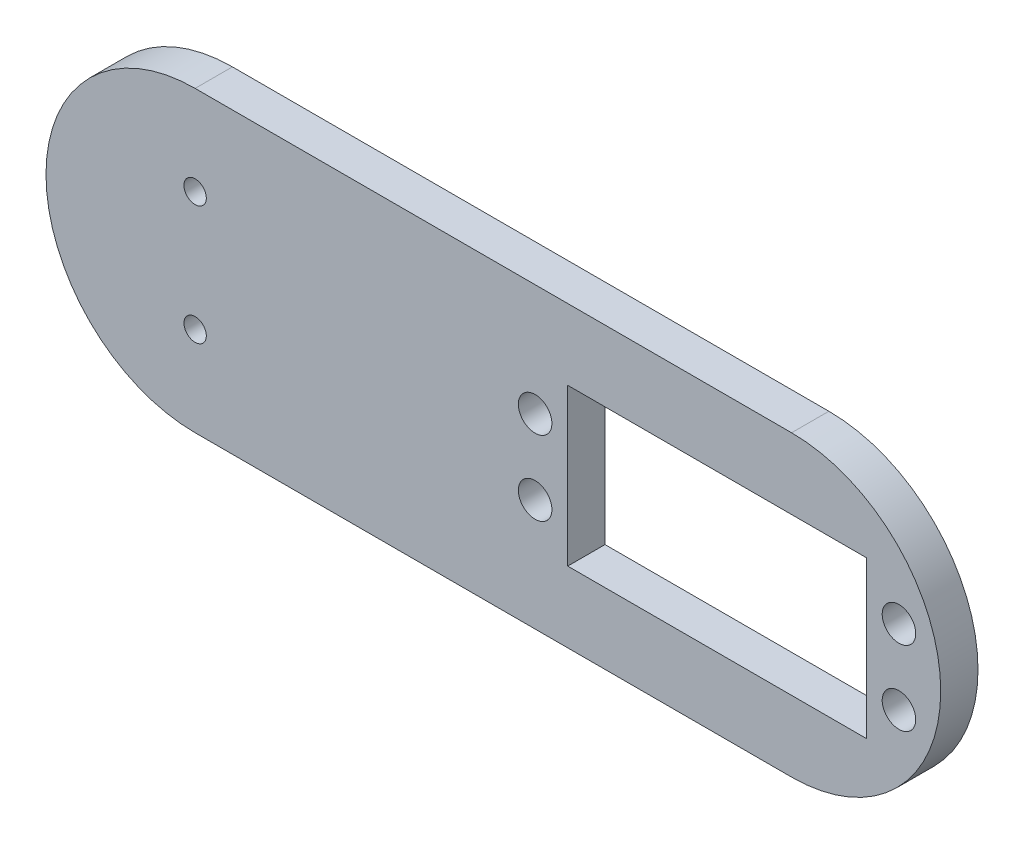
from build123d import *

# Parameters (mm, degrees)
BOSS_EXTRUDE1_DEPTH   = 5
CUT_EXTRUDE1_REACH    = 104.103
SKETCH2_R             = 1.5
BODY_MOVE_COPY1_ANGLE = 90
SKETCH19_R            = 2.25
SKETCH19_W            = 40.05
SKETCH19_H            = 21
CUT_EXTRUDE9_DEPTH    = 103.102889283


with BuildPart() as part:
    # Sketch1 → Boss-Extrude1 (new body)
    with BuildSketch(Plane(origin=(0, 0, 0), x_dir=(1, 0, 0), z_dir=(0, 1, 0))):
        with BuildLine():
            Line((80, -20), (0, -20))
            ThreePointArc((0, -20), (-20, 0), (0, 20))
            Line((0, 20), (80, 20))
            ThreePointArc((80, 20), (100, 0), (80, -20))
        make_face()
    extrude(amount=BOSS_EXTRUDE1_DEPTH)

    # Sketch2 → Cut-Extrude1 (cut, up to next)
    with BuildSketch(Plane(origin=(0, 5, 0), x_dir=(1, 0, 0), z_dir=(0, 1, 0)), mode=Mode.PRIVATE) as cut_extrude1_sk1:
        with Locations(Location((0.002, 7.999999875, 0), (0, 0, 270))):
            Circle(SKETCH2_R)
    cut_extrude1_tool1 = extrude(cut_extrude1_sk1.sketch, amount=-CUT_EXTRUDE1_REACH, mode=Mode.PRIVATE) & part.part
    # Sketch2 → Cut-Extrude1 (cut, up to next)
    with BuildSketch(Plane(origin=(0, 5, 0), x_dir=(1, 0, 0), z_dir=(0, 1, 0)), mode=Mode.PRIVATE) as cut_extrude1_sk2:
        with Locations(Location((0.002, -8.00000025, 0), (0, 0, 270))):
            Circle(SKETCH2_R)
    cut_extrude1_tool2 = extrude(cut_extrude1_sk2.sketch, amount=-CUT_EXTRUDE1_REACH, mode=Mode.PRIVATE) & part.part
    add(cut_extrude1_tool1.solids().sort_by_distance((0.002, 5, -8))[0], mode=Mode.SUBTRACT)
    add(cut_extrude1_tool2.solids().sort_by_distance((0.002, 5, 8))[0], mode=Mode.SUBTRACT)


with BuildPart() as part_1:
    # Body-Move/Copy1: moved
    add(part.part.rotate(Axis((0, 0, 0), (1, 0, 0)), BODY_MOVE_COPY1_ANGLE))

    # Sketch19 → Cut-Extrude9 (cut, through all)
    with BuildSketch(Plane.XY.offset(5)):
        with Locations((94.4, -5)):
            Circle(SKETCH19_R)
        with Locations(Location((94.4, 5, 0), (0, 0, 180))):
            Circle(SKETCH19_R)
        with Locations(Location((45.6, 5, 0), (0, 0, 180))):
            Circle(SKETCH19_R)
        with Locations((45.6, -5)):
            Circle(SKETCH19_R)
        with Locations((70, 0)):
            Rectangle(SKETCH19_W, SKETCH19_H)
    extrude(amount=-CUT_EXTRUDE9_DEPTH, mode=Mode.SUBTRACT)


with BuildPart() as part_2:
    # Body-Move/Copy5: moved
    add(part_1.part.moved(Location((-120, 0, 0))))


with BuildPart() as part_3:
    # Body-Move/Copy6: moved
    add(part_2.part.moved(Location((0, 0, -5))))


solid = part_3.part
